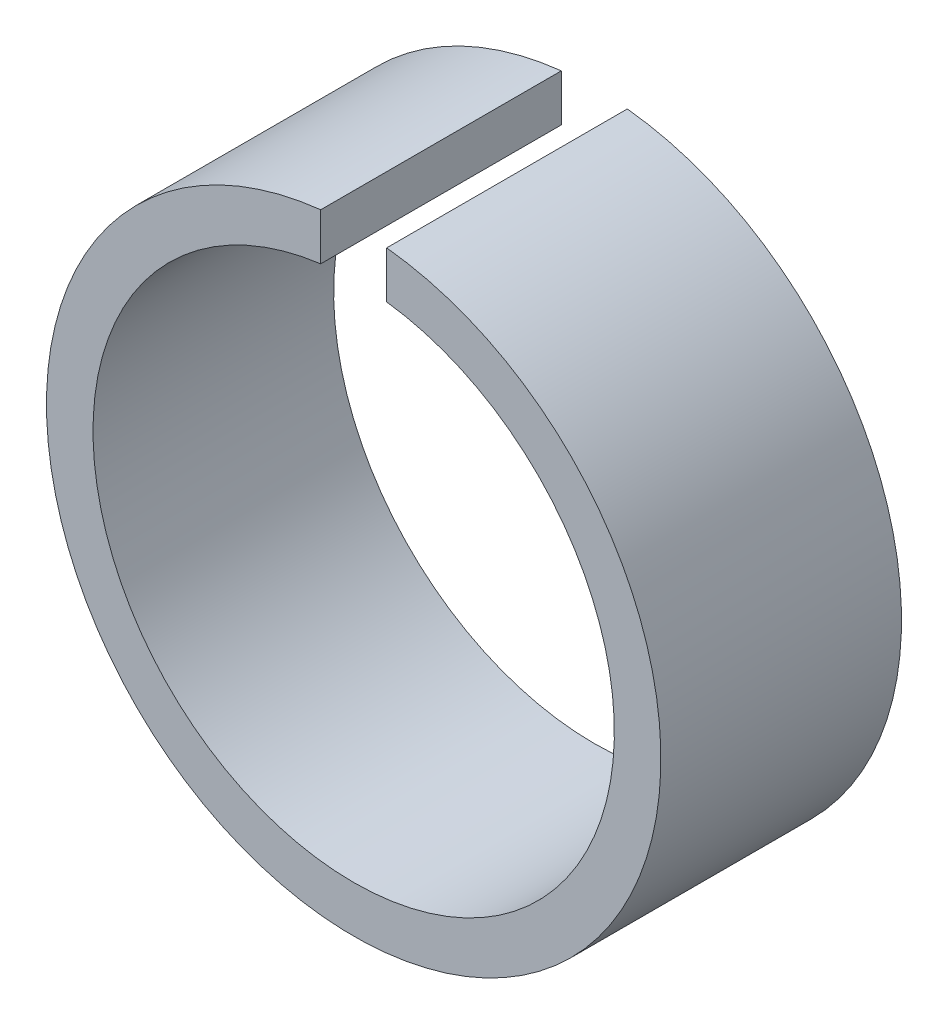
from build123d import *

# Parameters (mm, degrees)
BOSS_EXTRUDE1_DEPTH = 19.05


with BuildPart() as part:
    # Sketch1 → Boss-Extrude1 (new body)
    with BuildSketch(Plane.XY):
        with BuildLine():
            Line((-2.612031703, 24.179826522), (-2.612031703, 20.471533812))
            ThreePointArc((-2.612031703, 20.471533812), (0, -20.6375), (2.612031703, 20.471533812))
            Line((2.612031703, 20.471533812), (2.612031703, 24.179826522))
            ThreePointArc((2.612031703, 24.179826522), (0, -24.3205), (-2.612031703, 24.179826522))
        make_face()
    extrude(amount=BOSS_EXTRUDE1_DEPTH)


solid = part.part
